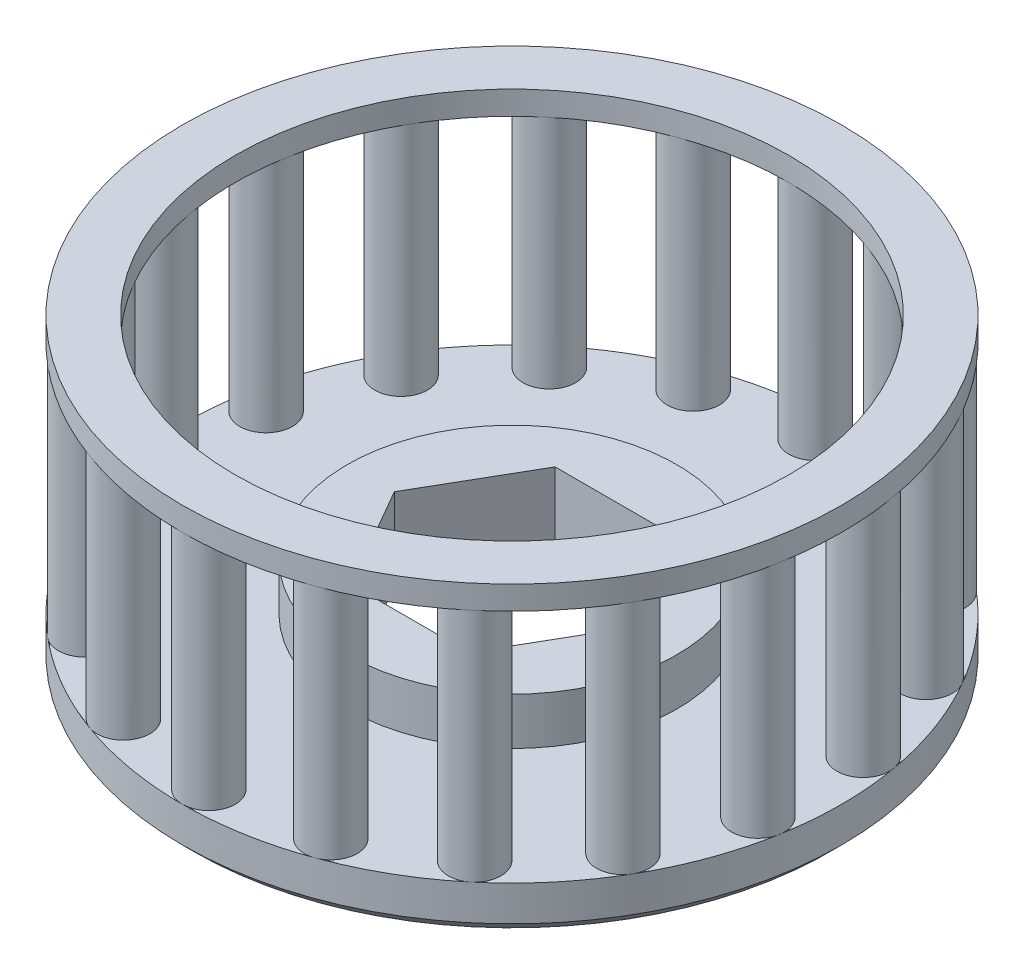
from build123d import *

# Parameters (mm, degrees)
SKETCH1_R           = 14
BOSS_EXTRUDE1_DEPTH = 2
SKETCH2_R           = 1.12
BOSS_EXTRUDE2_DEPTH = 10
SKETCH3_R           = 14
SKETCH3_R_2         = 11.76
BOSS_EXTRUDE3_DEPTH = 1
CHAMFER1_SIZE       = 0.5
SKETCH5_R           = 7
BOSS_EXTRUDE4_DEPTH = 2


with BuildPart() as part:
    # Sketch1 → Boss-Extrude1 (new body)
    with BuildSketch(Plane(origin=(0, 0, 0), x_dir=(1, 0, 0), z_dir=(0, 1, 0))):
        with Locations(Location((0, 0, 0), (0, 0, 270))):
            Circle(SKETCH1_R)
        Polygon((5, 0), (2.5, 4.330127019), (-2.5, 4.330127019), (-5, 0), (-2.5, -4.330127019), (2.5, -4.330127019), align=None, mode=Mode.SUBTRACT)
    extrude(amount=BOSS_EXTRUDE1_DEPTH)

    # Sketch2 → Boss-Extrude2 (add)
    with BuildSketch(Plane(origin=(0, 2, 0), x_dir=(1, 0, 0), z_dir=(0, 1, 0))):
        with BuildLine():
            ThreePointArc((0, 14), (-1.12, 12.88), (0, 11.76))
            Line((0, 11.76), (0, 14))
        make_face()
        with BuildLine():
            Line((0, 14), (0, 11.76))
            ThreePointArc((0, 11.76), (0.791959595, 12.088040405), (1.12, 12.88))
            ThreePointArc((1.12, 12.88), (0.791959595, 13.671959595), (0, 14))
        make_face()
        with Locations(Location((4.405219446, 12.103240956, 0), (0, 0, 69.999194591))):
            Circle(SKETCH2_R)
        with Locations(Location((8.279104413, 9.866652427, 0), (0, 0, 49.999187687))):
            Circle(SKETCH2_R)
        with Locations(Location((11.154407201, 6.44, 0), (0, 0, 29.999182162))):
            Circle(SKETCH2_R)
        with Locations(Location((12.684323859, 2.236588528, 0), (0, 0, 9.999177247))):
            Circle(SKETCH2_R)
        with Locations(Location((12.684323859, -2.236588528, 0), (0, 0, 349.999173281))):
            Circle(SKETCH2_R)
        with Locations(Location((11.154407201, -6.44, 0), (0, 0, 329.99917002))):
            Circle(SKETCH2_R)
        with Locations(Location((8.279104413, -9.866652427, 0), (0, 0, 309.999169093))):
            Circle(SKETCH2_R)
        with Locations(Location((4.405219446, -12.103240956, 0), (0, 0, 289.999169998))):
            Circle(SKETCH2_R)
        with Locations(Location((-4.405219446, -12.103240956, 0), (0, 0, 249.999176515))):
            Circle(SKETCH2_R)
        with Locations(Location((-8.279104413, -9.866652427, 0), (0, 0, 229.999182687))):
            Circle(SKETCH2_R)
        with Locations(Location((-11.154407201, -6.44, 0), (0, 0, 209.999188831))):
            Circle(SKETCH2_R)
        with Locations(Location((-12.684323859, -2.236588528, 0), (0, 0, 189.999194613))):
            Circle(SKETCH2_R)
        with Locations(Location((-12.684323859, 2.236588528, 0), (0, 0, 169.999199466))):
            Circle(SKETCH2_R)
        with Locations(Location((-11.154407201, 6.44, 0), (0, 0, 149.999202654))):
            Circle(SKETCH2_R)
        with Locations(Location((-8.279104413, 9.866652427, 0), (0, 0, 129.999204018))):
            Circle(SKETCH2_R)
        with Locations(Location((-4.405219446, 12.103240956, 0), (0, 0, 109.99920326))):
            Circle(SKETCH2_R)
        with Locations(Location((0, -12.88, 0), (0, 0, 269.999172475))):
            Circle(SKETCH2_R)
    extrude(amount=BOSS_EXTRUDE2_DEPTH)

    # Sketch3 → Boss-Extrude3 (add)
    with BuildSketch(Plane(origin=(0, 12, 0), x_dir=(1, 0, 0), z_dir=(0, 1, 0))):
        with Locations(Location((0, 0, 0), (0, 0, 90.000063859))):
            Circle(SKETCH3_R)
        with Locations(Location((0, 0, 0), (0, 0, 270))):
            Circle(SKETCH3_R_2, mode=Mode.SUBTRACT)
    extrude(amount=BOSS_EXTRUDE3_DEPTH)

    # Chamfer1
    chamfer1_edges = [part.edges().sort_by_distance(p)[0] for p in [
        (0, 0, -4.330127019),
        (-3.75, 0, -2.165063509),
        (-3.75, 0, 2.165063509),
        (0, 0, 4.330127019),
        (0, 0, -14),
        (3.75, 0, 2.165063509),
        (3.75, 0, -2.165063509),
    ]]
    chamfer(chamfer1_edges, length=CHAMFER1_SIZE)

    # Sketch5 → Boss-Extrude4 (add)
    with BuildSketch(Plane(origin=(0, 2, 0), x_dir=(1, 0, 0), z_dir=(0, 1, 0))):
        with Locations(Location((0, 0, 0), (0, 0, 270))):
            Circle(SKETCH5_R)
        Polygon((5, 0), (2.5, 4.330127019), (-2.5, 4.330127019), (-5, 0), (-2.5, -4.330127019), (2.5, -4.330127019), align=None, mode=Mode.SUBTRACT)
    extrude(amount=BOSS_EXTRUDE4_DEPTH)


solid = part.part
